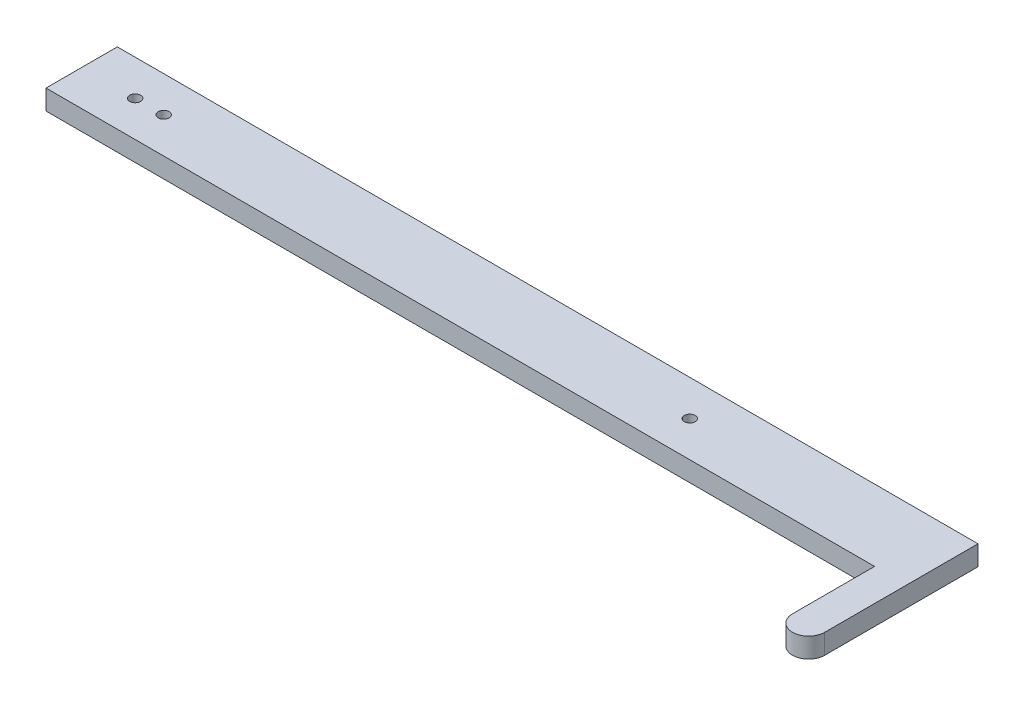
from build123d import *

# Parameters (mm, degrees)
SKETCH1_W           = 241.3
SKETCH1_H           = 20
BOSS_EXTRUDE1_DEPTH = 5.588
CUT_EXTRUDE1_REACH  = 169.751
SKETCH2_R           = 1.525
SKETCH3_W           = 9
SKETCH3_H           = 23
BOSS_EXTRUDE2_DEPTH = 5.588
BOSS_EXTRUDE3_DEPTH = 5.588


with BuildPart() as part:
    # Sketch1 → Boss-Extrude1 (new body)
    with BuildSketch(Plane(origin=(0, 0, 0), x_dir=(1, 0, 0), z_dir=(0, 1, 0))):
        with Locations((-46.608825085, 1.565543133)):
            Rectangle(SKETCH1_W, SKETCH1_H)
    extrude(amount=BOSS_EXTRUDE1_DEPTH)

    # Sketch2 → Cut-Extrude1 (cut, up to next)
    with BuildSketch(Plane(origin=(0, 5.588, 0), x_dir=(1, 0, 0), z_dir=(0, 1, 0)), mode=Mode.PRIVATE) as cut_extrude1_sk1:
        with Locations(Location((3.241174915, 1.565543133, 0), (0, 0, 270))):
            Circle(SKETCH2_R)
    cut_extrude1_tool1 = extrude(cut_extrude1_sk1.sketch, amount=-CUT_EXTRUDE1_REACH, mode=Mode.PRIVATE) & part.part
    # Sketch2 → Cut-Extrude1 (cut, up to next)
    with BuildSketch(Plane(origin=(0, 5.588, 0), x_dir=(1, 0, 0), z_dir=(0, 1, 0)), mode=Mode.PRIVATE) as cut_extrude1_sk2:
        with Locations(Location((-152.258825085, 1.565543133, 0), (0, 0, 270))):
            Circle(SKETCH2_R)
    cut_extrude1_tool2 = extrude(cut_extrude1_sk2.sketch, amount=-CUT_EXTRUDE1_REACH, mode=Mode.PRIVATE) & part.part
    # Sketch2 → Cut-Extrude1 (cut, up to next)
    with BuildSketch(Plane(origin=(0, 5.588, 0), x_dir=(1, 0, 0), z_dir=(0, 1, 0)), mode=Mode.PRIVATE) as cut_extrude1_sk3:
        with Locations(Location((-144.258825085, 1.565543133, 0), (0, 0, 270))):
            Circle(SKETCH2_R)
    cut_extrude1_tool3 = extrude(cut_extrude1_sk3.sketch, amount=-CUT_EXTRUDE1_REACH, mode=Mode.PRIVATE) & part.part
    add(cut_extrude1_tool1.solids().sort_by_distance((3.241175, 5.588, -1.565543))[0], mode=Mode.SUBTRACT)
    add(cut_extrude1_tool2.solids().sort_by_distance((-152.258825, 5.588, -1.565543))[0], mode=Mode.SUBTRACT)
    add(cut_extrude1_tool3.solids().sort_by_distance((-144.258825, 5.588, -1.565543))[0], mode=Mode.SUBTRACT)

    # Sketch3 → Boss-Extrude2 (add)
    with BuildSketch(Plane(origin=(0, 5.588, 0), x_dir=(1, 0, 0), z_dir=(0, 1, 0))):
        with Locations((69.541174915, -19.934456867)):
            Rectangle(SKETCH3_W, SKETCH3_H)
    extrude(amount=-BOSS_EXTRUDE2_DEPTH)

    # Sketch4 → Boss-Extrude3 (add)
    with BuildSketch(Plane(origin=(0, 5.588, 0), x_dir=(1, 0, 0), z_dir=(0, 1, 0))):
        with BuildLine():
            Line((65.041174915, -31.434456867), (74.041174915, -31.434456867))
            ThreePointArc((74.041174915, -31.434456867), (69.541174915, -35.934456867), (65.041174915, -31.434456867))
        make_face()
    extrude(amount=-BOSS_EXTRUDE3_DEPTH)


solid = part.part
